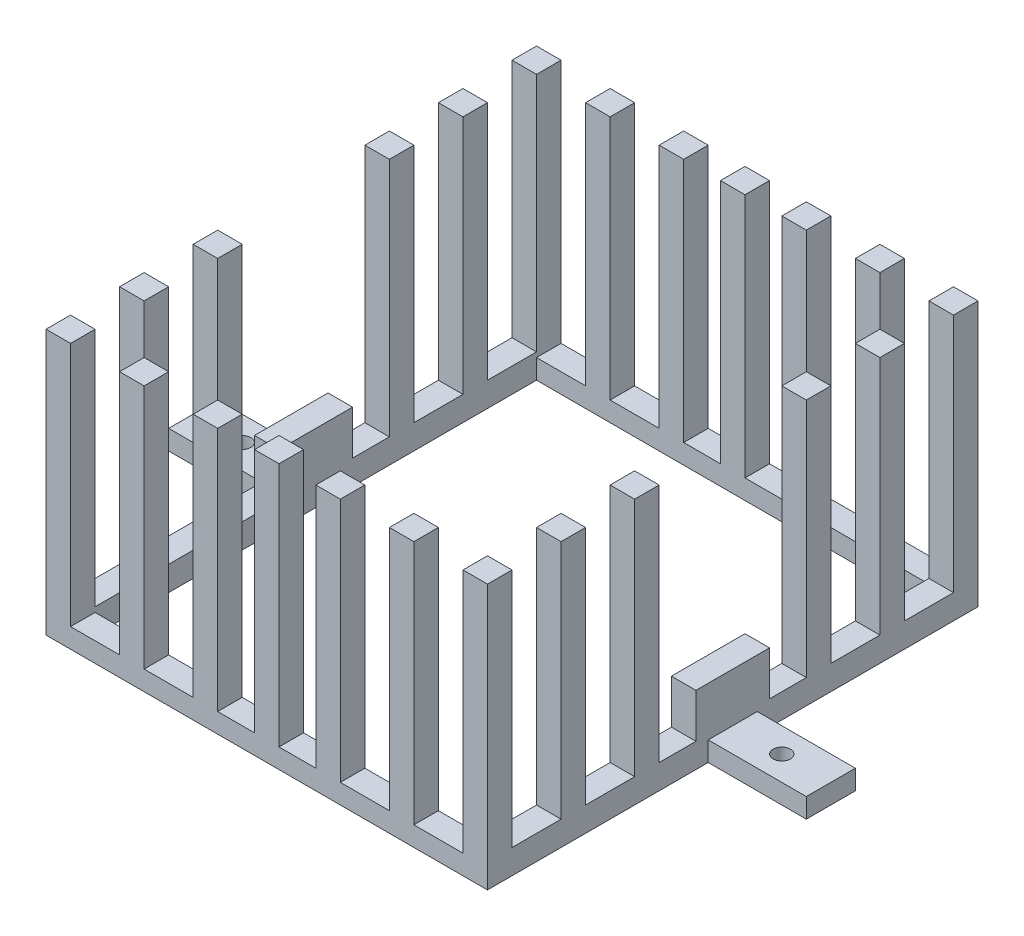
from build123d import *

# Parameters (mm, degrees)
SKETCH1_W           = 80
SKETCH1_H           = 90
SKETCH1_R           = 1.75
BOSS_EXTRUDE1_DEPTH = 4
SKETCH2_W           = 80
SKETCH2_H           = 90
BOSS_EXTRUDE2_DEPTH = 50
SKETCH3_W           = 5
SKETCH3_H           = 15
CUT_EXTRUDE1_DEPTH  = 40
SKETCH6_W           = 10
SKETCH6_H           = 50
SKETCH6_W_2         = 7.5
CUT_EXTRUDE5_DEPTH  = 159.164471358
SKETCH8_W           = 10
SKETCH8_H           = 49
CUT_EXTRUDE6_DEPTH  = 159.164471358


with BuildPart() as part:
    # Sketch1 → Boss-Extrude1 (new body)
    with BuildSketch(Plane(origin=(0, 0, 0), x_dir=(1, 0, 0), z_dir=(0, 1, 0))):
        Polygon((0, 0), (90, 0), (90, 45), (110, 45), (110, 55), (90, 55), (90, 100), (0, 100), (0, 55), (-20, 55), (-20, 45), (0, 45), align=None)
        with Locations((45, 50)):
            Rectangle(SKETCH1_W, SKETCH1_H, mode=Mode.SUBTRACT)
        with Locations(Location((-10, 50, 0), (0, 0, 270))):
            Circle(SKETCH1_R, mode=Mode.SUBTRACT)
        with Locations(Location((100, 50, 0), (0, 0, 270))):
            Circle(SKETCH1_R, mode=Mode.SUBTRACT)
    extrude(amount=BOSS_EXTRUDE1_DEPTH)

    # Sketch2 → Boss-Extrude2 (add)
    with BuildSketch(Plane(origin=(0, 4, 0), x_dir=(1, 0, 0), z_dir=(0, 1, 0))):
        Polygon((0, 45), (0, 0), (90, 0), (90, 45), (90, 55), (90, 100), (0, 100), (0, 55), align=None)
        with Locations((45, 50)):
            Rectangle(SKETCH2_W, SKETCH2_H, mode=Mode.SUBTRACT)
    extrude(amount=BOSS_EXTRUDE2_DEPTH)

    # Sketch3 → Cut-Extrude1 (cut)
    with BuildSketch(Plane(origin=(0, 54, 0), x_dir=(1, 0, 0), z_dir=(0, 1, 0))):
        with Locations((87.5, 50)):
            Rectangle(SKETCH3_W, SKETCH3_H)
        with Locations((2.5, 50)):
            Rectangle(SKETCH3_W, SKETCH3_H)
    extrude(amount=-CUT_EXTRUDE1_DEPTH, mode=Mode.SUBTRACT)

    # Sketch6 → Cut-Extrude5 (cut, through all)
    with BuildSketch(Plane(origin=(0, 0, -100), x_dir=(-1, 0, 0), z_dir=(0, 0, -1))):
        with Locations((-80, 29)):
            Rectangle(SKETCH6_W, SKETCH6_H)
        with Locations((-65, 29)):
            Rectangle(SKETCH6_W, SKETCH6_H)
        with Locations((-51.25, 29)):
            Rectangle(SKETCH6_W_2, SKETCH6_H)
        with Locations((-38.75, 29)):
            Rectangle(SKETCH6_W_2, SKETCH6_H)
        with Locations((-25, 29)):
            Rectangle(SKETCH6_W, SKETCH6_H)
        with Locations((-10, 29)):
            Rectangle(SKETCH6_W, SKETCH6_H)
    extrude(amount=-CUT_EXTRUDE5_DEPTH, mode=Mode.SUBTRACT)

    # Sketch8 → Cut-Extrude6 (cut, through all)
    with BuildSketch(Plane(origin=(90, 0, 0), x_dir=(0, 0, -1), z_dir=(1, 0, 0))):
        with Locations((10, 29.5)):
            Rectangle(SKETCH8_W, SKETCH8_H)
        with Locations((25, 29.5)):
            Rectangle(SKETCH8_W, SKETCH8_H)
        Polygon((42.5, 54), (35, 54), (35, 5), (42.5, 5), (42.5, 14), align=None)
        Polygon((57.5, 14), (57.5, 5), (65, 5), (65, 54), (57.5, 54), align=None)
        with Locations((75, 29.5)):
            Rectangle(SKETCH8_W, SKETCH8_H)
        with Locations((90, 29.5)):
            Rectangle(SKETCH8_W, SKETCH8_H)
    extrude(amount=-CUT_EXTRUDE6_DEPTH, mode=Mode.SUBTRACT)


solid = part.part
